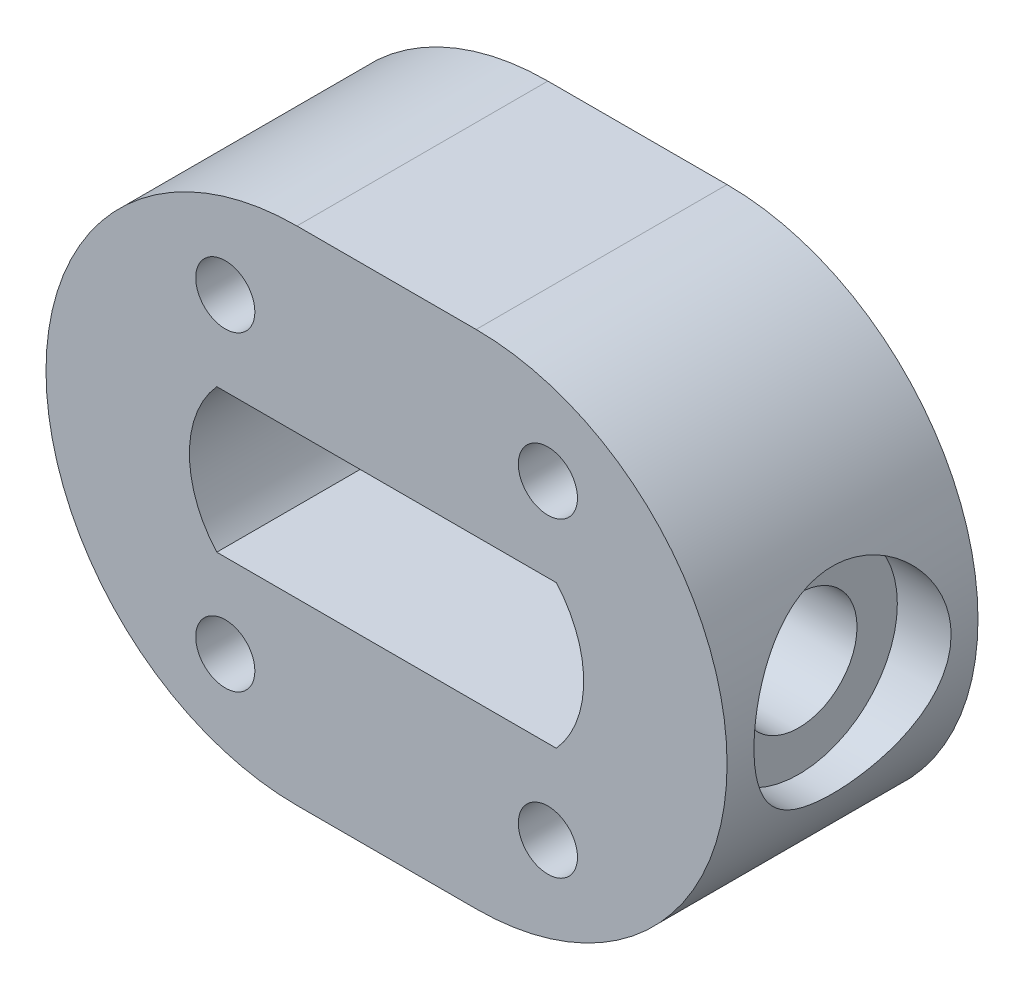
from build123d import *

# Parameters (mm, degrees)
BOSS_EXTRUDE1_DEPTH     = 14
M4_TAPPED_HOLE2_D       = 3.3
CUT_EXTRUDE1_REACH      = 44.849
CUT_EXTRUDE1_END_RADIUS = 6
SKETCH5_R               = 3.25
SKETCH6_R               = 5.5
CUT_EXTRUDE2_DEPTH      = 3


with BuildPart() as part:
    # Sketch1 → Boss-Extrude1 (new body)
    with BuildSketch(Plane.XY):
        with BuildLine():
            Line((0, 14), (10, 14))
            ThreePointArc((10, 14), (24, 0), (10, -14))
            Line((10, -14), (0, -14))
            ThreePointArc((0, -14), (-14, 0), (0, 14))
        make_face()
        with BuildLine():
            Line((-4.472135955, 4), (14.472135955, 4))
            ThreePointArc((14.472135955, 4), (16, 0), (14.472135955, -4))
            Line((14.472135955, -4), (-4.472135955, -4))
            ThreePointArc((-4.472135955, -4), (-6, 0), (-4.472135955, 4))
        make_face(mode=Mode.SUBTRACT)
    extrude(amount=BOSS_EXTRUDE1_DEPTH)

    # M4 Tapped Hole2 (through all)
    with Locations(Plane(origin=(-3.996947905, 8.674675786, 14), x_dir=(1, 0, 0), z_dir=(0, 0, 1))):
        with Locations((0, 0), (18, 0), (18, -17.349351572), (0, -17.349351572)):
            Hole(M4_TAPPED_HOLE2_D / 2)

    # Cut-Extrude1: up to this cylinder (the profile starts outside it)
    cut_extrude1_end = Plane(origin=(10, 0, 7), z_dir=(0, 0, -1)) * Cylinder(CUT_EXTRUDE1_END_RADIUS, 102.698, mode=Mode.PRIVATE)
    # Sketch5 → Cut-Extrude1 (cut, up to the surface)
    with BuildSketch(Plane(origin=(24, 0, 0), x_dir=(0, 0, -1), z_dir=(1, 0, 0)), mode=Mode.PRIVATE) as cut_extrude1_sk1:
        with Locations((-7, 0)):
            Circle(SKETCH5_R)
    cut_extrude1_tool1 = extrude(cut_extrude1_sk1.sketch, amount=-CUT_EXTRUDE1_REACH, mode=Mode.PRIVATE) - cut_extrude1_end
    add(cut_extrude1_tool1.solids().sort_by_distance((24, 0, 7))[0], mode=Mode.SUBTRACT)

    # Sketch6 → Cut-Extrude2 (cut)
    with BuildSketch(Plane(origin=(24, 0, 0), x_dir=(0, 0, -1), z_dir=(1, 0, 0))):
        with Locations((-7, 0)):
            Circle(SKETCH6_R)
    extrude(amount=-CUT_EXTRUDE2_DEPTH, mode=Mode.SUBTRACT)


solid = part.part
